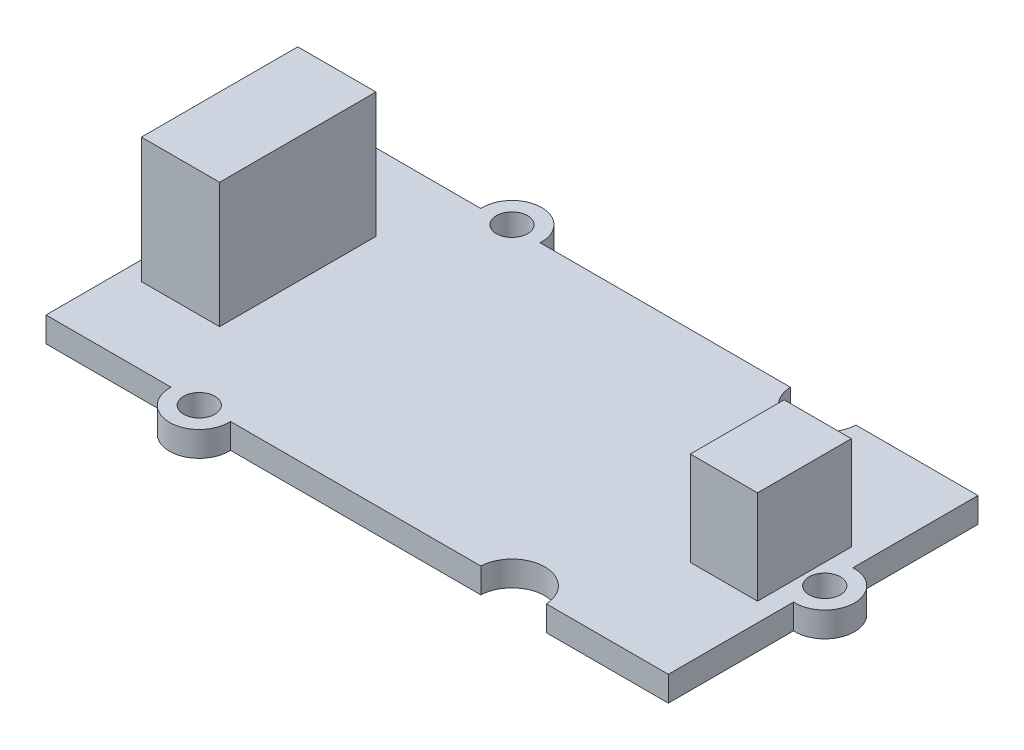
from build123d import *

# Parameters (mm, degrees)
SKETCH1_W           = 39.8
SKETCH1_H           = 19.8
BOSS_EXTRUDE1_DEPTH = 1.6
SKETCH2_R           = 1.9
BOSS_EXTRUDE2_DEPTH = 1.6
SKETCH3_R           = 1
SKETCH3_R_2         = 2.1
CUT_EXTRUDE1_DEPTH  = 1.6
SKETCH4_W           = 4.3
SKETCH4_H           = 6
BOSS_EXTRUDE3_DEPTH = 6
SKETCH5_W           = 5
SKETCH5_H           = 10
BOSS_EXTRUDE4_DEPTH = 8


with BuildPart() as part:
    # Sketch1 → Boss-Extrude1 (new body)
    with BuildSketch(Plane(origin=(0, 0, 0), x_dir=(1, 0, 0), z_dir=(0, 1, 0))):
        Rectangle(SKETCH1_W, SKETCH1_H)
    extrude(amount=BOSS_EXTRUDE1_DEPTH)

    # Sketch2 → Boss-Extrude2 (add)
    with BuildSketch(Plane(origin=(0, 0, 0), x_dir=(1, 0, 0), z_dir=(0, 1, 0))):
        with Locations((-10, 10)):
            Circle(SKETCH2_R)
        with Locations((20, 0)):
            Circle(SKETCH2_R)
        with Locations((-10, -10)):
            Circle(SKETCH2_R)
    extrude(amount=BOSS_EXTRUDE2_DEPTH)

    # Sketch3 → Cut-Extrude1 (cut)
    with BuildSketch(Plane(origin=(0, 1.6, 0), x_dir=(1, 0, 0), z_dir=(0, 1, 0))):
        with Locations(Location((-10, 10, 0), (0, 0, 270))):
            Circle(SKETCH3_R)
        with Locations(Location((-10, -10, 0), (0, 0, 270))):
            Circle(SKETCH3_R)
        with Locations(Location((20, 0, 0), (0, 0, 270))):
            Circle(SKETCH3_R)
        with Locations((10, 10)):
            Circle(SKETCH3_R_2)
        with Locations((10, -10)):
            Circle(SKETCH3_R_2)
        with Locations((-20, 0)):
            Circle(SKETCH3_R_2)
    extrude(amount=-CUT_EXTRUDE1_DEPTH, mode=Mode.SUBTRACT)

    # Sketch4 → Boss-Extrude3 (add)
    with BuildSketch(Plane(origin=(0, 1.6, 0), x_dir=(1, 0, 0), z_dir=(0, 1, 0))):
        with Locations((16.55, 0)):
            Rectangle(SKETCH4_W, SKETCH4_H)
    extrude(amount=BOSS_EXTRUDE3_DEPTH)

    # Sketch5 → Boss-Extrude4 (add)
    with BuildSketch(Plane(origin=(0, 1.6, 0), x_dir=(1, 0, 0), z_dir=(0, 1, 0))):
        with Locations((-16.2, 0)):
            Rectangle(SKETCH5_W, SKETCH5_H)
    extrude(amount=BOSS_EXTRUDE4_DEPTH)


solid = part.part
